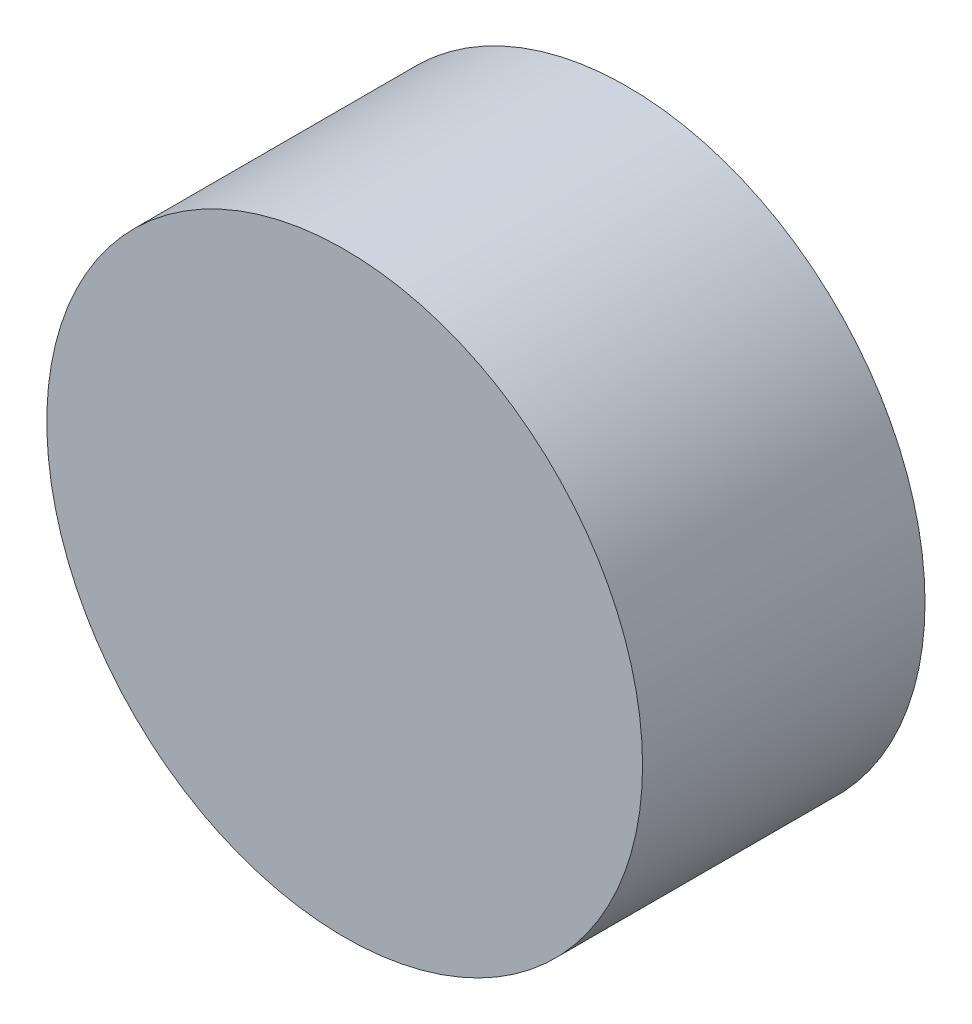
from build123d import *

# Parameters (mm, degrees)
SKETCH_1_R      = 29
EXTRUDE_1_DEPTH = 27.5


with BuildPart() as part:
    # 草图1 → 凸台-拉伸1 (new body)
    with BuildSketch(Plane.XY):
        Circle(SKETCH_1_R)
    extrude(amount=EXTRUDE_1_DEPTH)


solid = part.part
